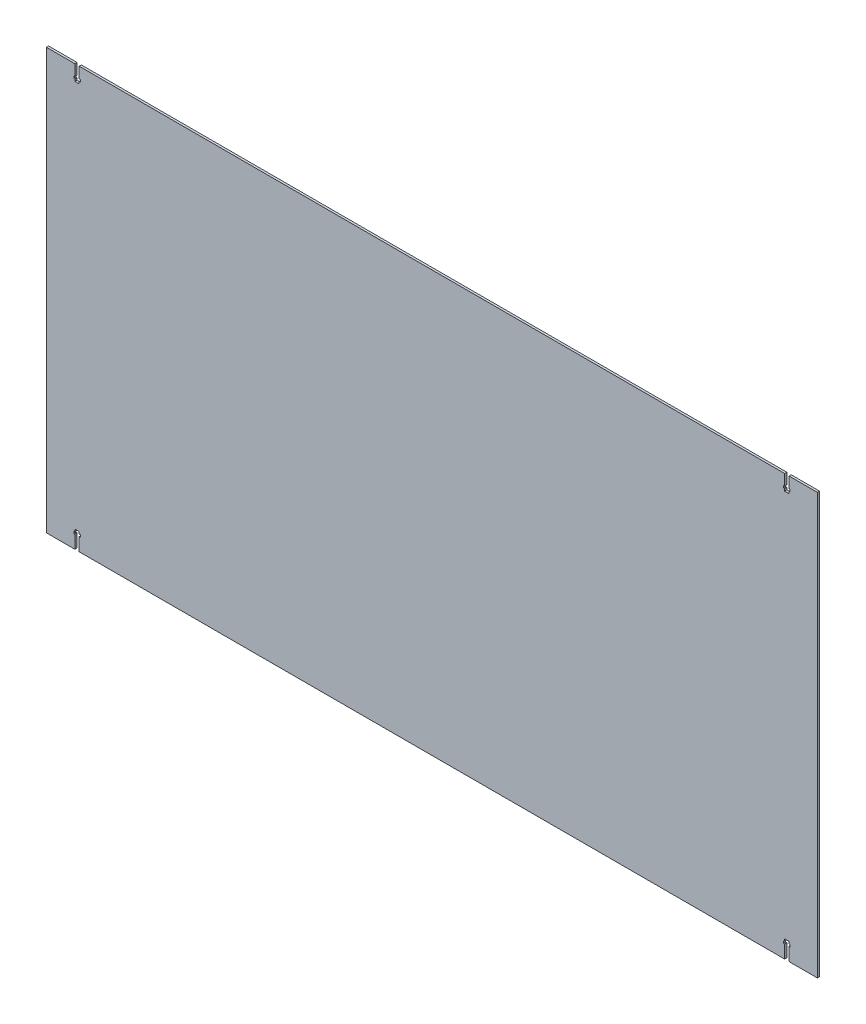
from build123d import *

# Parameters (mm, degrees)
SKETCH1_W               = 1117.6
SKETCH1_H               = 609.6
BOSS_EXTRUDE1_DEPTH     = 3.175
SKETCH4_W               = 6.35
SKETCH4_H               = 3.175
CUT_EXTRUDE2_DEPTH      = 25.4
SKETCH5_W               = 9.525
SKETCH5_H               = 3.175
CUT_EXTRUDE3_DEPTH      = 25.4
MIRROR2_COPY_1_SKETCH_W = 6.35
MIRROR2_COPY_1_SKETCH_H = 3.175
MIRROR2_COPY_1_DEPTH    = 25.4
MIRROR2_COPY_2_SKETCH_W = 9.525
MIRROR2_COPY_2_SKETCH_H = 3.175
MIRROR2_COPY_2_DEPTH    = 25.4


with BuildPart() as part:
    # Sketch1 → Boss-Extrude1 (new body)
    with BuildSketch(Plane.XY):
        with Locations((558.8, 304.8)):
            Rectangle(SKETCH1_W, SKETCH1_H)
    extrude(amount=BOSS_EXTRUDE1_DEPTH)

    # Sketch4 → Cut-Extrude2 (cut)
    with BuildSketch(Plane(origin=(0, 612.775, 0), x_dir=(1, 0, 0), z_dir=(0, 1, 0))):
        with Locations((44.429546792, -1.5875)):
            Rectangle(SKETCH4_W, SKETCH4_H)
    cut_extrude2 = extrude(amount=-CUT_EXTRUDE2_DEPTH, mode=Mode.SUBTRACT)

    # Sketch5 → Cut-Extrude3 (cut)
    with BuildSketch(Plane.XY.offset(3.175)):
        with Locations((44.429546792, 592.1375)):
            Rectangle(SKETCH5_W, SKETCH5_H)
    cut_extrude3 = extrude(amount=-CUT_EXTRUDE3_DEPTH, mode=Mode.SUBTRACT)

    # Mirror1: Cut-Extrude2, Cut-Extrude3 across plane
    add(cut_extrude2.mirror(Plane.ZY.offset(-558.8)), mode=Mode.SUBTRACT)
    add(cut_extrude3.mirror(Plane.ZY.offset(-558.8)), mode=Mode.SUBTRACT)

    # Mirror2: Cut-Extrude2, Cut-Extrude3 across plane
    add(cut_extrude2.mirror(Plane.ZX.offset(306.3875)), mode=Mode.SUBTRACT)
    add(cut_extrude3.mirror(Plane.ZX.offset(306.3875)), mode=Mode.SUBTRACT)

    # Mirror2 copy 1 sketch → Mirror2 copy 1 (cut)
    with BuildSketch(Plane(origin=(1117.6, 0, 0), x_dir=(-1, 0, 0), z_dir=(0, -1, 0))):
        with Locations((44.429546792, -1.5875)):
            Rectangle(MIRROR2_COPY_1_SKETCH_W, MIRROR2_COPY_1_SKETCH_H)
    extrude(amount=-MIRROR2_COPY_1_DEPTH, mode=Mode.SUBTRACT)

    # Mirror2 copy 2 sketch → Mirror2 copy 2 (cut)
    with BuildSketch(Plane(origin=(1117.6, 612.775, 3.175), x_dir=(-1, 0, 0), z_dir=(0, 0, 1))):
        with Locations((44.429546792, 592.1375)):
            Rectangle(MIRROR2_COPY_2_SKETCH_W, MIRROR2_COPY_2_SKETCH_H)
    extrude(amount=-MIRROR2_COPY_2_DEPTH, mode=Mode.SUBTRACT)


solid = part.part
